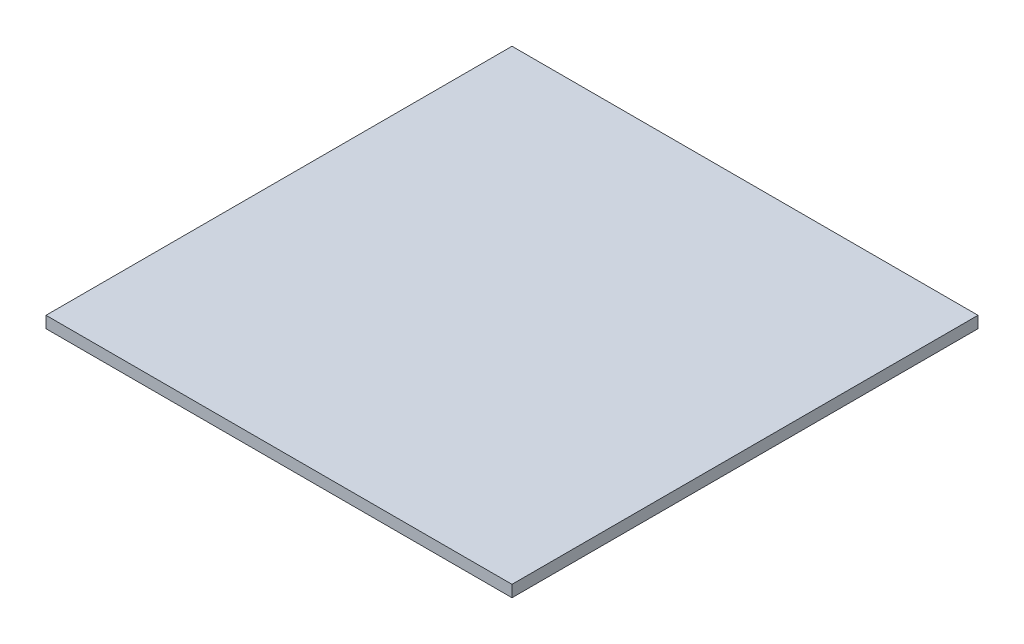
from build123d import *

# Parameters (mm, degrees)
SKETCH_1_W      = 200
SKETCH_1_H      = 200
EXTRUDE_1_DEPTH = 5


with BuildPart() as part:
    # 草图1 → 凸台-拉伸1 (new body)
    with BuildSketch(Plane(origin=(0, 0, 0), x_dir=(1, 0, 0), z_dir=(0, 1, 0))):
        with Locations((100, 100)):
            Rectangle(SKETCH_1_W, SKETCH_1_H)
    extrude(amount=EXTRUDE_1_DEPTH)


solid = part.part
